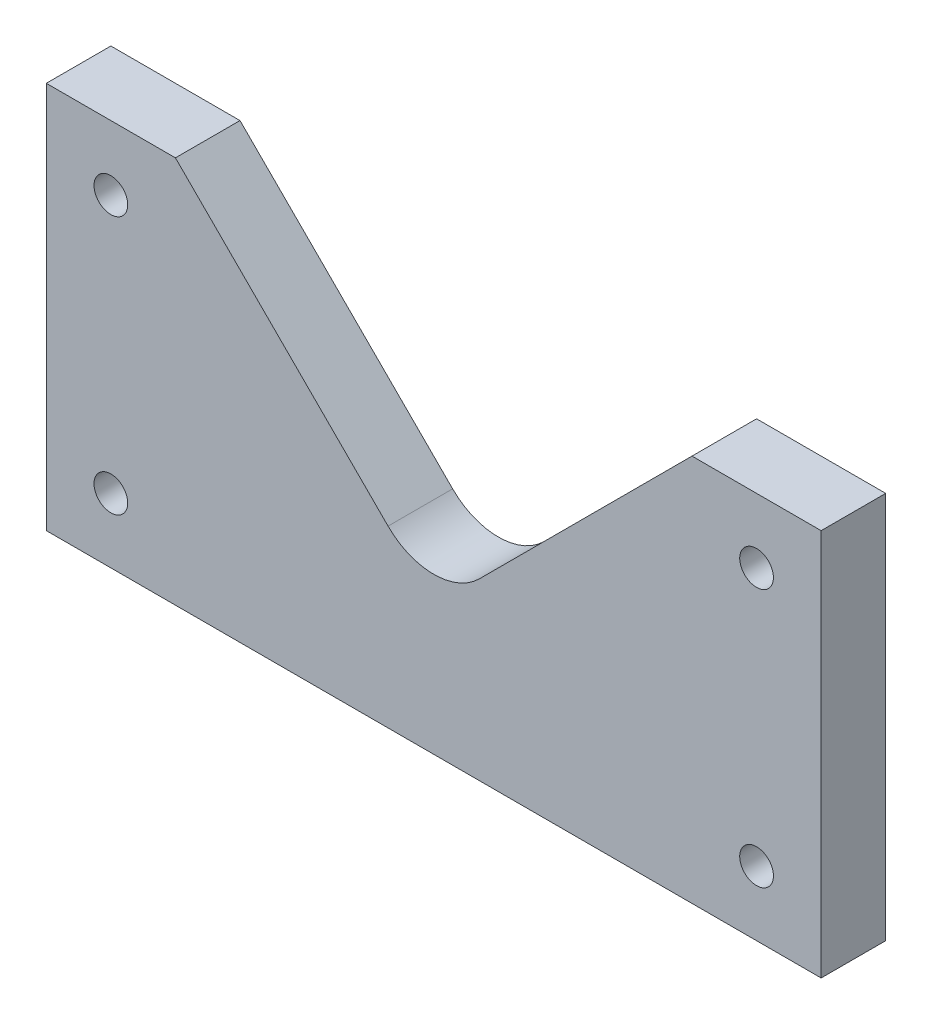
from build123d import *

# Parameters (mm, degrees)
SKETCH1_W                = 152.4
SKETCH1_H                = 101.6
BOSS_EXTRUDE1_DEPTH      = 6.35
CUT_EXTRUDE1_DEPTH       = 93.457395594
SKETCH3_W                = 152.4
SKETCH3_H                = 25.4
CUT_EXTRUDE2_DEPTH       = 93.457395594
G_0_261_DIAMETER_HOLE1_D = 6.6294
FILLET1_R                = 12.7


with BuildPart() as part:
    # Sketch1 → Boss-Extrude1 (new, symmetric)
    with BuildSketch(Plane.XY):
        Rectangle(SKETCH1_W, SKETCH1_H)
    extrude(amount=BOSS_EXTRUDE1_DEPTH, both=True)

    # Sketch2 → Cut-Extrude1 (cut, through all)
    with BuildSketch(Plane.XY.offset(6.35)):
        Polygon((0, 0), (50.8, 50.8), (-50.8, 50.8), align=None)
    extrude(amount=-CUT_EXTRUDE1_DEPTH, mode=Mode.SUBTRACT)

    # Sketch3 → Cut-Extrude2 (cut, through all)
    with BuildSketch(Plane.XY.offset(6.35)):
        with Locations((0, -38.1)):
            Rectangle(SKETCH3_W, SKETCH3_H)
    extrude(amount=-CUT_EXTRUDE2_DEPTH, mode=Mode.SUBTRACT)

    # G (0.261) Diameter Hole1 (through all)
    with Locations(Plane.XY.offset(6.35)):
        with Locations((-63.5, 38.1), (-63.5, -12.7), (63.5, -12.7), (63.5, 38.1)):
            Hole(G_0_261_DIAMETER_HOLE1_D / 2)

    # Fillet1
    fillet1_edges = [part.edges().sort_by_distance(p)[0] for p in [
        (0, 0, 0),
    ]]
    fillet(fillet1_edges, radius=FILLET1_R)


solid = part.part
